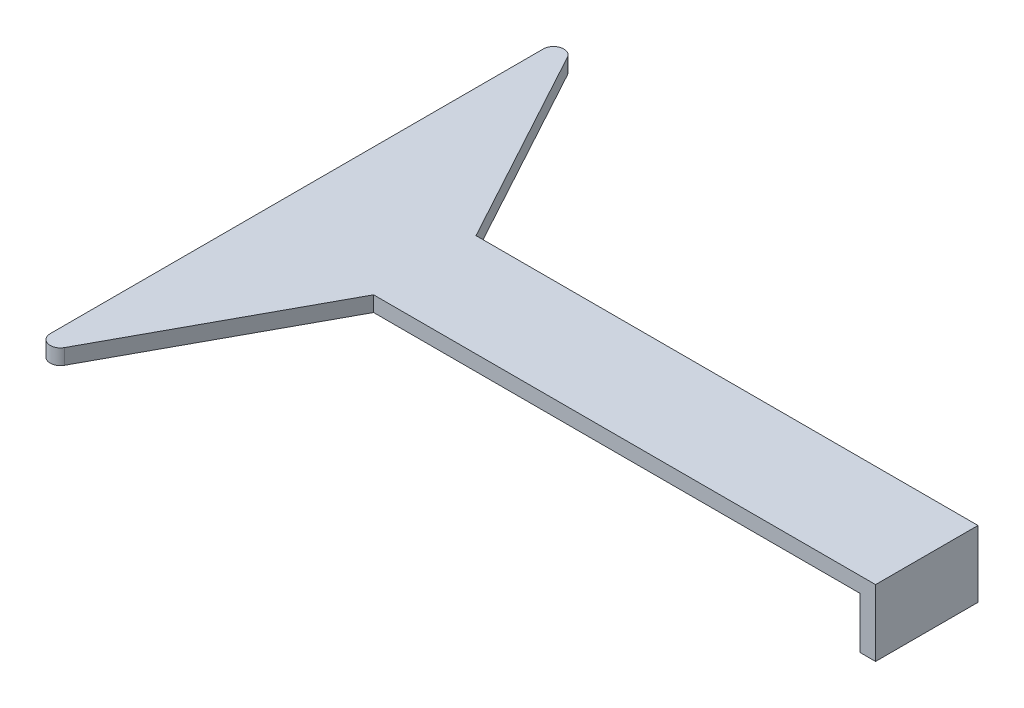
from build123d import *

# Parameters (mm, degrees)
SKETCH1_W           = 120
SKETCH1_H           = 20
BOSS_EXTRUDE1_DEPTH = 3
SKETCH2_W           = 20
SKETCH2_H           = 13
BOSS_EXTRUDE2_DEPTH = 3
BOSS_EXTRUDE3_DEPTH = 3
BOSS_EXTRUDE4_DEPTH = 3


with BuildPart() as part:
    # Sketch1 → Boss-Extrude1 (new body)
    with BuildSketch(Plane(origin=(0, 0, 0), x_dir=(1, 0, 0), z_dir=(0, 1, 0))):
        with Locations((-60, -10)):
            Rectangle(SKETCH1_W, SKETCH1_H)
    extrude(amount=BOSS_EXTRUDE1_DEPTH)

    # Sketch2 → Boss-Extrude2 (add)
    with BuildSketch(Plane(origin=(0, 0, 0), x_dir=(0, 0, -1), z_dir=(1, 0, 0))):
        with Locations((-10, -3.5)):
            Rectangle(SKETCH2_W, SKETCH2_H)
    extrude(amount=BOSS_EXTRUDE2_DEPTH)

    # Sketch3 → Boss-Extrude3 (add)
    with BuildSketch(Plane(origin=(0, 3, 0), x_dir=(1, 0, 0), z_dir=(0, 1, 0))):
        with BuildLine():
            Line((-120, -20), (-120, -58.131635164))
            ThreePointArc((-120, -58.131635164), (-118.492697657, -60.069997622), (-116.242750981, -59.086661805))
            Line((-116.242750981, -59.086661805), (-95, -20))
            Line((-95, -20), (-120, -20))
        make_face()
        with BuildLine():
            Line((-120, 0), (-120, 38.131635164))
            ThreePointArc((-120, 38.131635164), (-118.492697657, 40.069997622), (-116.242750981, 39.086661805))
            Line((-116.242750981, 39.086661805), (-95, 0))
            Line((-95, 0), (-120, 0))
        make_face()
    extrude(amount=-BOSS_EXTRUDE3_DEPTH)

    # Sketch5 → Boss-Extrude4 (add)
    with BuildSketch(Plane.XZ):
        with BuildLine():
            Line((-55, 7.5), (-75, 7.5))
            ThreePointArc((-75, 7.5), (-77.5, 10), (-75, 12.5))
            Line((-75, 12.5), (-55, 12.5))
            ThreePointArc((-55, 12.5), (-52.5, 10), (-55, 7.5))
        make_face()
    extrude(amount=BOSS_EXTRUDE4_DEPTH)


solid = part.part
